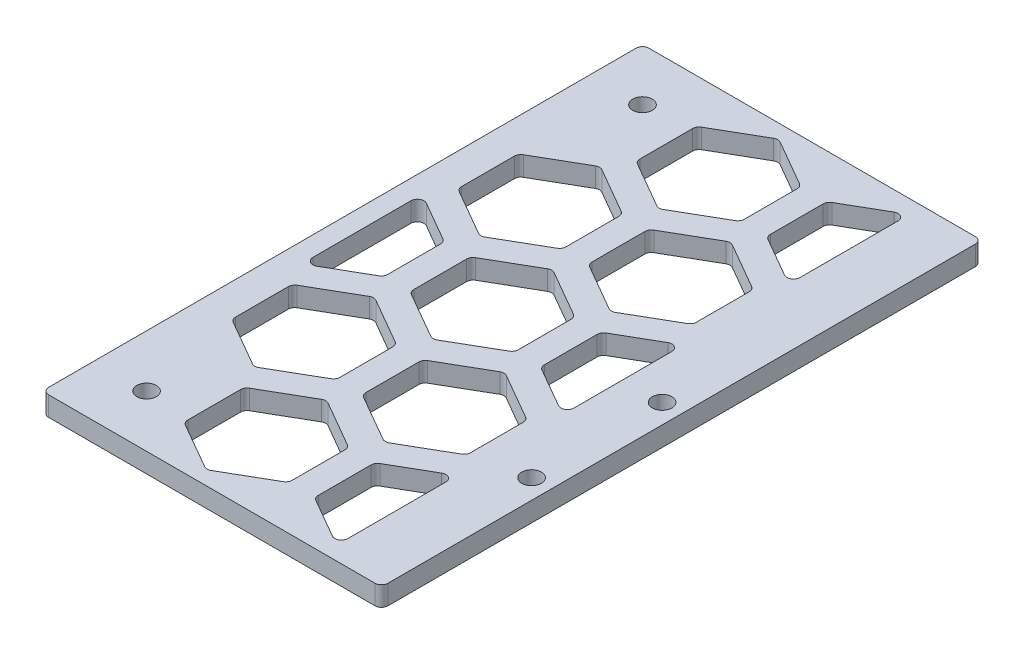
from build123d import *

# Parameters (mm, degrees)
SKETCH_1_W          = 52
SKETCH_1_H          = 92
SKETCH_1_R          = 1.5
EXTRUDE_1_DEPTH     = 3
FILLET_1_R          = 1
CUT_EXTRUDE_1_DEPTH = 10
FILLET_2_R          = 1


with BuildPart() as part:
    # 草图1 → 凸台-拉伸1 (new body)
    with BuildSketch(Plane(origin=(0, 0, 0), x_dir=(1, 0, 0), z_dir=(0, 1, 0))):
        with Locations((26, 46)):
            Rectangle(SKETCH_1_W, SKETCH_1_H)
        with Locations(Location((49, 46, 0), (0, 0, 270))):
            Circle(SKETCH_1_R, mode=Mode.SUBTRACT)
        with Locations(Location((49, 26, 0), (0, 0, 270))):
            Circle(SKETCH_1_R, mode=Mode.SUBTRACT)
        with Locations(Location((8, 84, 0), (0, 0, 270))):
            Circle(SKETCH_1_R, mode=Mode.SUBTRACT)
        with Locations(Location((8, 8, 0), (0, 0, 270))):
            Circle(SKETCH_1_R, mode=Mode.SUBTRACT)
    extrude(amount=EXTRUDE_1_DEPTH)

    # 圆角1
    fillet_1_edges = [part.edges().sort_by_distance(p)[0] for p in [
        (0, 1.5, -92),
        (52, 1.5, -92),
        (52, 1.5, 0),
        (0, 1.5, 0),
    ]]
    fillet(fillet_1_edges, radius=FILLET_1_R)

    # 草图2 → 切除-拉伸1 (cut)
    with BuildSketch(Plane(origin=(0, 3, 0), x_dir=(1, 0, 0), z_dir=(0, 1, 0))):
        Polygon((23, 89.878620458), (15, 85.259818305), (15, 76.022213998), (23, 71.403411844), (31, 76.022213998), (31, 85.259818305), align=None)
        Polygon((13, 72.558112383), (5, 67.939310229), (5, 58.701705922), (13, 54.082903769), (21, 58.701705922), (21, 67.939310229), align=None)
        Polygon((43, 89.878620458), (35, 85.259818305), (35, 76.022213998), (43, 71.403411844), align=None)
        Polygon((23, 55.237604307), (15, 50.618802154), (15, 41.381197846), (23, 36.762395693), (31, 41.381197846), (31, 50.618802154), align=None)
        Polygon((3, 36.762395693), (11, 41.381197846), (11, 50.618802154), (3, 55.237604307), align=None)
        Polygon((35, 50.618802154), (43, 55.237604307), (43, 36.762395693), (35, 41.381197846), align=None)
        Polygon((25, 67.939310229), (33, 72.558112383), (41, 67.939310229), (41, 58.701705922), (33, 54.082903769), (25, 58.701705922), align=None)
        Polygon((21, 24.060689771), (13, 19.441887617), (5, 24.060689771), (5, 33.298294078), (13, 37.917096231), (21, 33.298294078), align=None)
        Polygon((25, 33.298294078), (25, 24.060689771), (33, 19.441887617), (41, 24.060689771), (41, 33.298294078), (33, 37.917096231), align=None)
        Polygon((43, 2.121379542), (35, 6.740181695), (35, 15.977786002), (43, 20.596588156), align=None)
        Polygon((31, 6.740181695), (23, 2.121379542), (15, 6.740181695), (15, 15.977786002), (23, 20.596588156), (31, 15.977786002), align=None)
    extrude(amount=-CUT_EXTRUDE_1_DEPTH, mode=Mode.SUBTRACT)

    # 圆角2
    fillet_2_edges = [part.edges().sort_by_distance(p)[0] for p in [
        (23, 1.5, -55.237604307),
        (31, 1.5, -50.618802154),
        (31, 1.5, -41.381197846),
        (23, 1.5, -36.762395693),
        (15, 1.5, -41.381197846),
        (15, 1.5, -50.618802154),
        (25, 1.5, -58.701705922),
        (25, 1.5, -67.939310229),
        (33, 1.5, -72.558112383),
        (41, 1.5, -67.939310229),
        (41, 1.5, -58.701705922),
        (33, 1.5, -54.082903769),
        (3, 1.5, -36.762395693),
        (3, 1.5, -55.237604307),
        (11, 1.5, -50.618802154),
        (11, 1.5, -41.381197846),
        (25, 1.5, -33.298294078),
        (33, 1.5, -37.917096231),
        (41, 1.5, -33.298294078),
        (41, 1.5, -24.060689771),
        (33, 1.5, -19.441887617),
        (25, 1.5, -24.060689771),
        (13, 1.5, -72.558112383),
        (21, 1.5, -67.939310229),
        (21, 1.5, -58.701705922),
        (13, 1.5, -54.082903769),
        (5, 1.5, -58.701705922),
        (5, 1.5, -67.939310229),
        (43, 1.5, -89.878620458),
        (43, 1.5, -71.403411844),
        (35, 1.5, -76.022213998),
        (35, 1.5, -85.259818305),
        (21, 1.5, -33.298294078),
        (21, 1.5, -24.060689771),
        (13, 1.5, -19.441887617),
        (5, 1.5, -24.060689771),
        (5, 1.5, -33.298294078),
        (13, 1.5, -37.917096231),
        (35, 1.5, -41.381197846),
        (35, 1.5, -50.618802154),
        (43, 1.5, -55.237604307),
        (43, 1.5, -36.762395693),
        (43, 1.5, -20.596588156),
        (43, 1.5, -2.121379542),
        (35, 1.5, -6.740181695),
        (35, 1.5, -15.977786002),
        (31, 1.5, -15.977786002),
        (31, 1.5, -6.740181695),
        (23, 1.5, -2.121379542),
        (15, 1.5, -6.740181695),
        (15, 1.5, -15.977786002),
        (23, 1.5, -20.596588156),
        (23, 1.5, -89.878620458),
        (31, 1.5, -85.259818305),
        (31, 1.5, -76.022213998),
        (23, 1.5, -71.403411844),
        (15, 1.5, -76.022213998),
        (15, 1.5, -85.259818305),
    ]]
    fillet(fillet_2_edges, radius=FILLET_2_R)


solid = part.part
